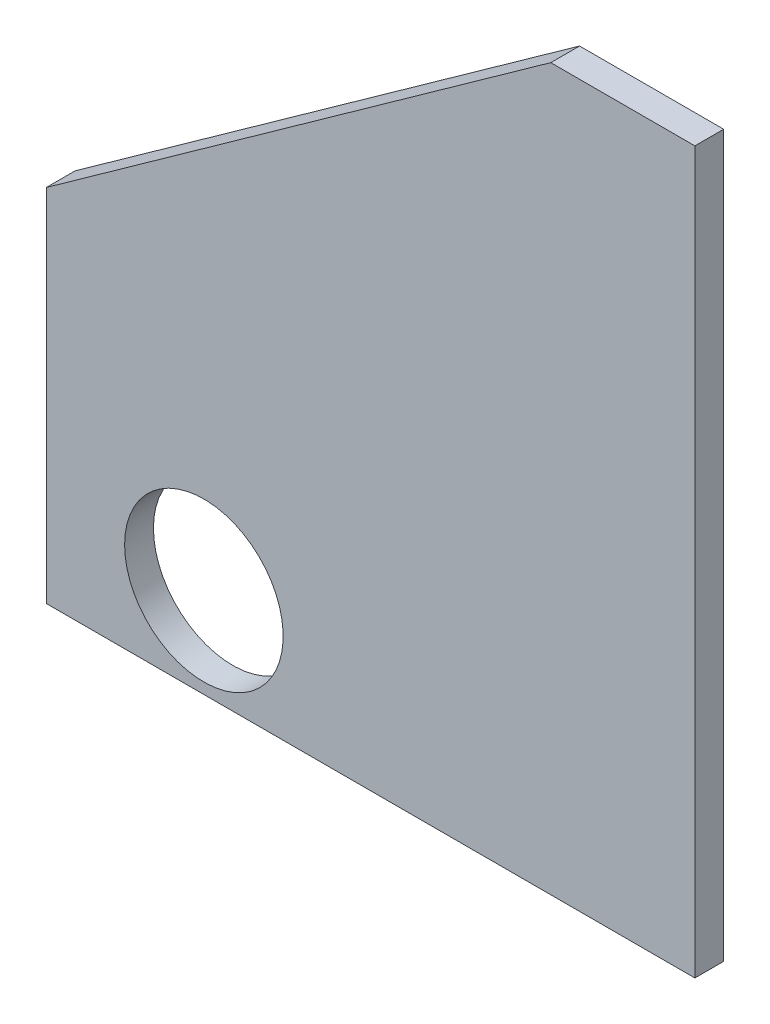
from build123d import *

# Parameters (mm, degrees)
BOSS_EXTRUDE1_DEPTH = 4
SKETCH2_R           = 11
CUT_EXTRUDE1_DEPTH  = 135.595690867


with BuildPart() as part:
    # Sketch1 → Boss-Extrude1 (new body)
    with BuildSketch(Plane.XY):
        Polygon((0, 0), (90, 0), (90, 100), (70, 100), (0, 50), align=None)
    extrude(amount=BOSS_EXTRUDE1_DEPTH)

    # Sketch2 → Cut-Extrude1 (cut, through all)
    with BuildSketch(Plane(origin=(0, 0, 0), x_dir=(-1, 0, 0), z_dir=(0, 0, -1))):
        with Locations((-21.867101934, 12.5)):
            Circle(SKETCH2_R)
    extrude(amount=-CUT_EXTRUDE1_DEPTH, mode=Mode.SUBTRACT)


solid = part.part
